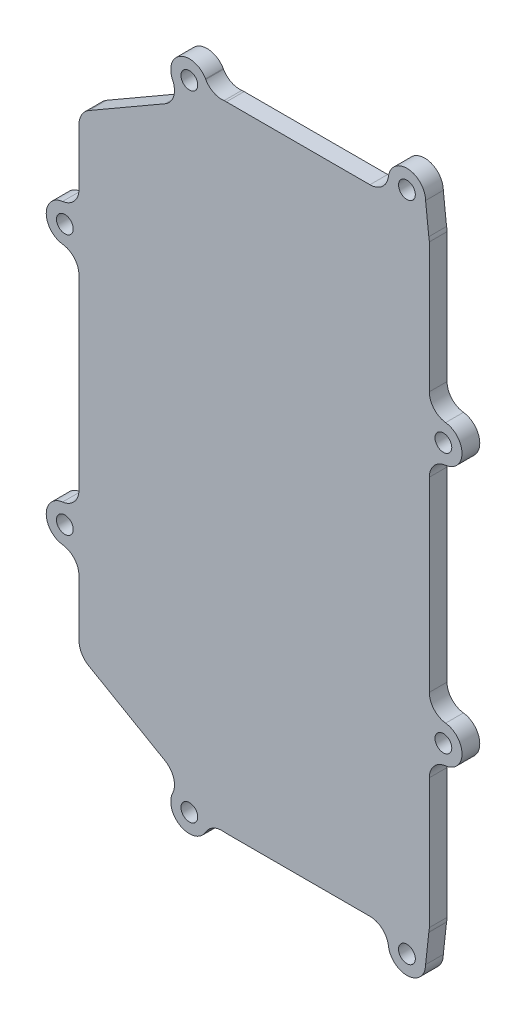
from build123d import *

# Parameters (mm, degrees)
BOSS_EXTRUDE1_DEPTH  = 4.7625
M4_CLEARANCE_HOLE1_D = 4.5


with BuildPart() as part:
    # Sketch1 → Boss-Extrude1 (new body)
    with BuildSketch(Plane.XY):
        with BuildLine():
            Line((-94, 144.919812433), (-94, 129.845444943))
            ThreePointArc((-94, 129.845444943), (-95.255453966, 126.532081848), (-98.39135, 124.882628688))
            ThreePointArc((-98.39135, 124.882628688), (-102.7827, 119.919812433), (-98.39135, 114.956996179))
            ThreePointArc((-98.39135, 114.956996179), (-95.255453966, 113.307543019), (-94, 109.994179924))
            Line((-94, 109.994179924), (-94, 60.005820076))
            ThreePointArc((-94, 60.005820076), (-95.255453966, 56.692456981), (-98.39135, 55.043003821))
            ThreePointArc((-98.39135, 55.043003821), (-102.7827, 50.080187567), (-98.39135, 45.117371312))
            ThreePointArc((-98.39135, 45.117371312), (-95.255453966, 43.467918152), (-94, 40.154555057))
            Line((-94, 40.154555057), (-94, 25.080187567))
            ThreePointArc((-94, 25.080187567), (-93.285154037, 22.412797084), (-91.332218978, 20.460357228))
            Line((-91.332218978, 20.460357228), (-70.871308953, 8.651857213))
            ThreePointArc((-70.871308953, 8.651857213), (-68.590749548, 5.788703611), (-68.871909852, 2.13910793))
            ThreePointArc((-68.871909852, 2.13910793), (-66.715485478, -4.460545697), (-60.042693242, -2.542359614))
            Line((-60.042693242, -2.542359614), (-59.97854154, -2.431202209))
            ThreePointArc((-59.97854154, -2.431202209), (-57.893008537, -0.462819662), (-55.068956864, 0.035888574))
            ThreePointArc((-55.068956864, 0.035888574), (-54.760620401, 0.008979702), (-54.451242271, 0))
            Line((-54.451242271, 0), (-15.925632509, 0))
            ThreePointArc((-15.925632509, 0), (-12.612269414, -1.255453966), (-10.962816255, -4.39135))
            ThreePointArc((-10.962816255, -4.39135), (-5.69510762, -8.773395406), (-1, -3.7827))
            Line((-1, -3.7827), (-0.126827546, 4.177751308))
            ThreePointArc((-0.126827546, 4.177751308), (-0.031801689, 4.752408162), (0, 5.334))
            Line((0, 5.334), (0, 40.154555057))
            ThreePointArc((0, 40.154555057), (1.255453966, 43.467918152), (4.39135, 45.117371312))
            ThreePointArc((4.39135, 45.117371312), (8.7827, 50.080187567), (4.39135, 55.043003821))
            ThreePointArc((4.39135, 55.043003821), (1.255453966, 56.692456981), (0, 60.005820076))
            Line((0, 60.005820076), (0, 109.994179924))
            ThreePointArc((0, 109.994179924), (1.255453966, 113.307543019), (4.39135, 114.956996179))
            ThreePointArc((4.39135, 114.956996179), (8.7827, 119.919812433), (4.39135, 124.882628688))
            ThreePointArc((4.39135, 124.882628688), (1.255453966, 126.532081848), (0, 129.845444943))
            Line((0, 129.845444943), (0, 164.666))
            ThreePointArc((0, 164.666), (-0.031801689, 165.247591838), (-0.126827546, 165.822248692))
            Line((-0.126827546, 165.822248692), (-1, 173.7827))
            ThreePointArc((-1, 173.7827), (-5.69510762, 178.773395406), (-10.962816255, 174.39135))
            ThreePointArc((-10.962816255, 174.39135), (-12.612269414, 171.255453966), (-15.925632509, 170))
            Line((-15.925632509, 170), (-54.451242271, 170))
            ThreePointArc((-54.451242271, 170), (-54.760620401, 169.991020298), (-55.068956864, 169.964111426))
            ThreePointArc((-55.068956864, 169.964111426), (-57.893008537, 170.462819662), (-59.97854154, 172.431202209))
            Line((-59.97854154, 172.431202209), (-60.042693242, 172.542359614))
            ThreePointArc((-60.042693242, 172.542359614), (-66.715485478, 174.460545697), (-68.871909852, 167.86089207))
            ThreePointArc((-68.871909852, 167.86089207), (-68.590749548, 164.211296389), (-70.871308953, 161.348142787))
            Line((-70.871308953, 161.348142787), (-91.332218978, 149.539642772))
            ThreePointArc((-91.332218978, 149.539642772), (-93.285154037, 147.587202916), (-94, 144.919812433))
        make_face()
    extrude(amount=-BOSS_EXTRUDE1_DEPTH)

    # M4 Clearance Hole1 (through all)
    with Locations(Plane(origin=(0, 0, -4.7625), x_dir=(-1, 0, 0), z_dir=(0, 0, -1))):
        with Locations((6, -3.7827), (-3.7827, 50.080187567), (-3.7827, 119.919812433), (6, 173.7827), (64.373242866, 170.04309173), (97.7827, 119.919812433), (97.7827, 50.080187567), (64.373242866, -0.04309173)):
            Hole(M4_CLEARANCE_HOLE1_D / 2)


solid = part.part
